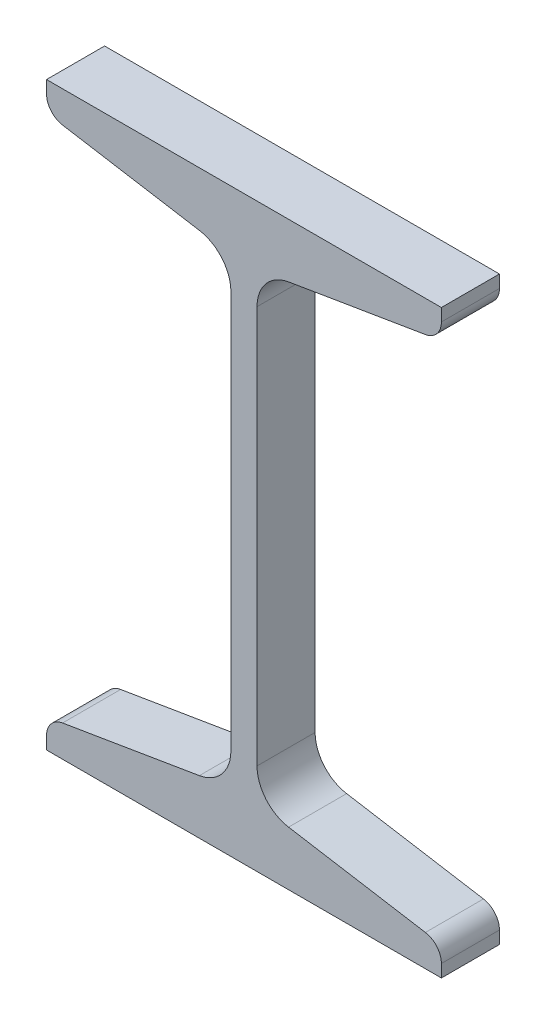
from build123d import *

# Parameters (mm, degrees)
EXTRUDE_1_DEPTH = 10
FILLET_1_R      = 3.3
FILLET_2_R      = 6.5


with BuildPart() as part:
    # 草图1 → 凸台-拉伸1 (new body)
    with BuildSketch(Plane.XY):
        Polygon((34, 50), (-34, 50), (-34, 45.045833333), (-2.25, 39.754166667), (-2.25, -39.754166667), (-34, -45.045833333), (-34, -50), (34, -50), (34, -45.045833333), (2.25, -39.754166667), (2.25, 39.754166667), (34, 45.045833333), align=None)
    extrude(amount=EXTRUDE_1_DEPTH)

    # 圆角1
    fillet_1_edges = [part.edges().sort_by_distance(p)[0] for p in [
        (-34, -45.045833333, 5),
        (-34, 45.045833333, 5),
        (34, 45.045833333, 5),
        (34, -45.045833333, 5),
    ]]
    fillet(fillet_1_edges, radius=FILLET_1_R)

    # 圆角2
    fillet_2_edges = [part.edges().sort_by_distance(p)[0] for p in [
        (-2.25, -39.754166667, 5),
        (-2.25, 39.754166667, 5),
        (2.25, 39.754166667, 5),
        (2.25, -39.754166667, 5),
    ]]
    fillet(fillet_2_edges, radius=FILLET_2_R)


solid = part.part
